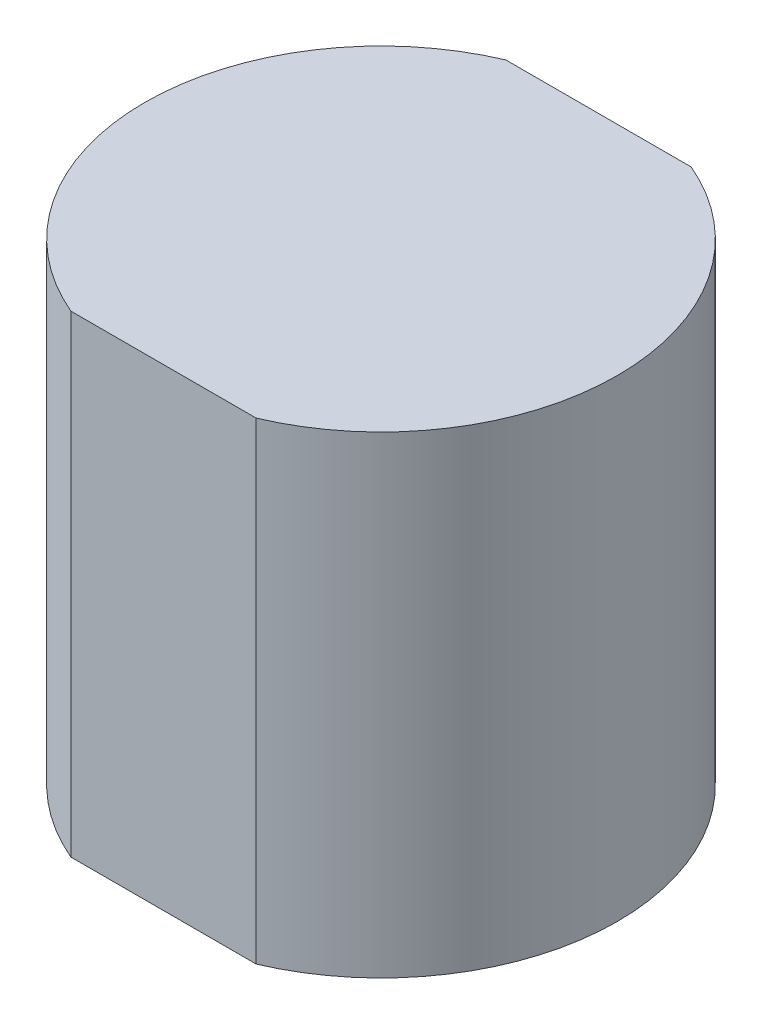
from build123d import *

# Parameters (mm, degrees)
SKETCH_1_R           = 250
EXTRUDE_1_DEPTH      = 500
SKETCH_2_OUTSIDE_W   = 675.206
SKETCH_2_OUTSIDE_H   = 675.206
SKETCH_2_OUTSIDE_W_2 = 546.506375228
SKETCH_2_OUTSIDE_H_2 = 460
CUT_EXTRUDE_1_DEPTH  = 599


with BuildPart() as part:
    # 草图1 → 凸台-拉伸1 (new body)
    with BuildSketch(Plane(origin=(0, 0, 0), x_dir=(1, 0, 0), z_dir=(0, 1, 0))):
        with Locations(Location((0, 0, 0), (0, 0, 270))):
            Circle(SKETCH_1_R)
    extrude(amount=EXTRUDE_1_DEPTH)

    # 草图2 outside → 切除-拉伸1 (cut)
    with BuildSketch(Plane.XZ):
        Rectangle(SKETCH_2_OUTSIDE_W, SKETCH_2_OUTSIDE_H)
        Rectangle(SKETCH_2_OUTSIDE_W_2, SKETCH_2_OUTSIDE_H_2, mode=Mode.SUBTRACT)
    extrude(amount=-CUT_EXTRUDE_1_DEPTH, mode=Mode.SUBTRACT)


solid = part.part
